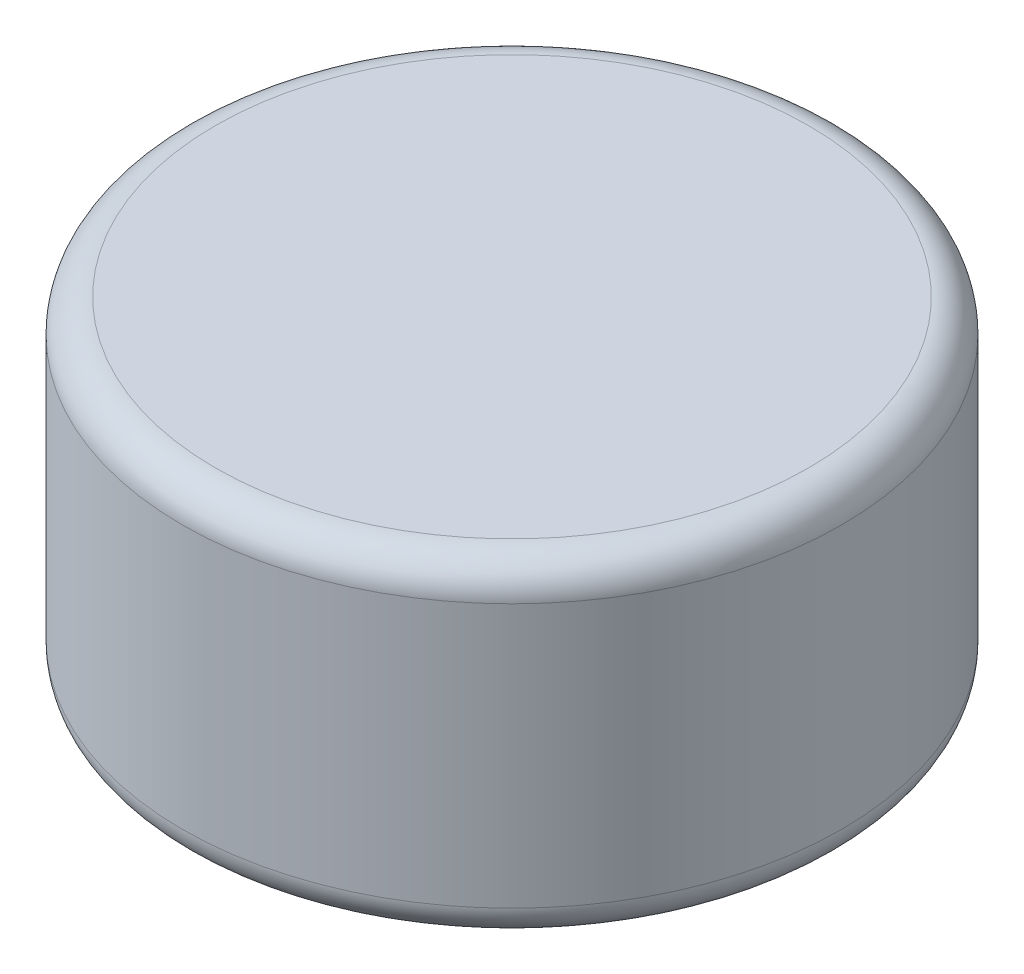
from build123d import *

# Parameters (mm, degrees)
SKETCH1_R           = 5
BOSS_EXTRUDE1_DEPTH = 5
FILLET1_R           = 0.5


with BuildPart() as part:
    # Sketch1 → Boss-Extrude1 (new body)
    with BuildSketch(Plane(origin=(0, 0, 0), x_dir=(1, 0, 0), z_dir=(0, 1, 0))):
        with Locations(Location((0, 0, 0), (0, 0, 270))):
            Circle(SKETCH1_R)
    extrude(amount=BOSS_EXTRUDE1_DEPTH)

    # Fillet1
    fillet1_edges = [part.edges().sort_by_distance(p)[0] for p in [
        (0, 0, -5),
        (0, 5, -5),
    ]]
    fillet(fillet1_edges, radius=FILLET1_R)


solid = part.part
